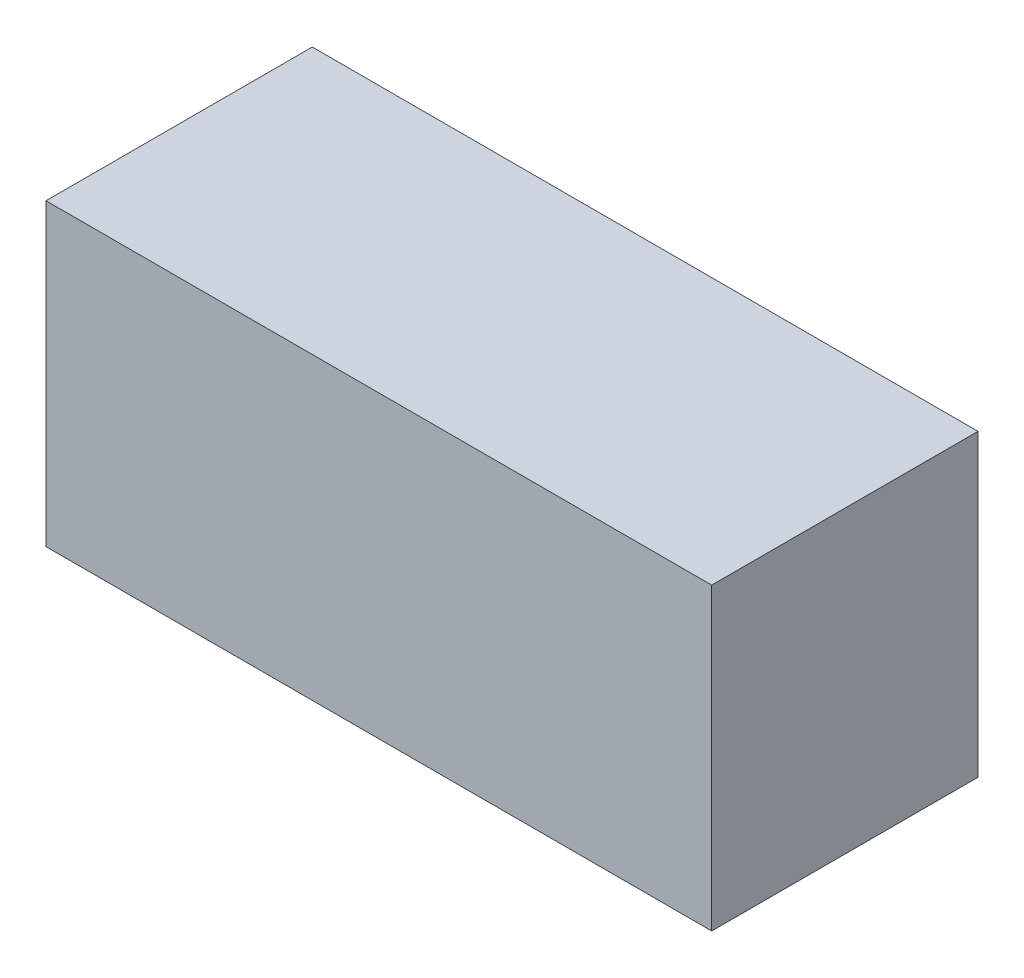
from build123d import *

# Parameters (mm, degrees)
SKETCH2_W           = 100
SKETCH2_H           = 40
BOSS_EXTRUDE2_DEPTH = 45


with BuildPart() as part:
    # Sketch2 → Boss-Extrude2 (new body)
    with BuildSketch(Plane(origin=(0, 0, 0), x_dir=(1, 0, 0), z_dir=(0, 1, 0))):
        with Locations((50, 20)):
            Rectangle(SKETCH2_W, SKETCH2_H)
    extrude(amount=BOSS_EXTRUDE2_DEPTH)


solid = part.part
